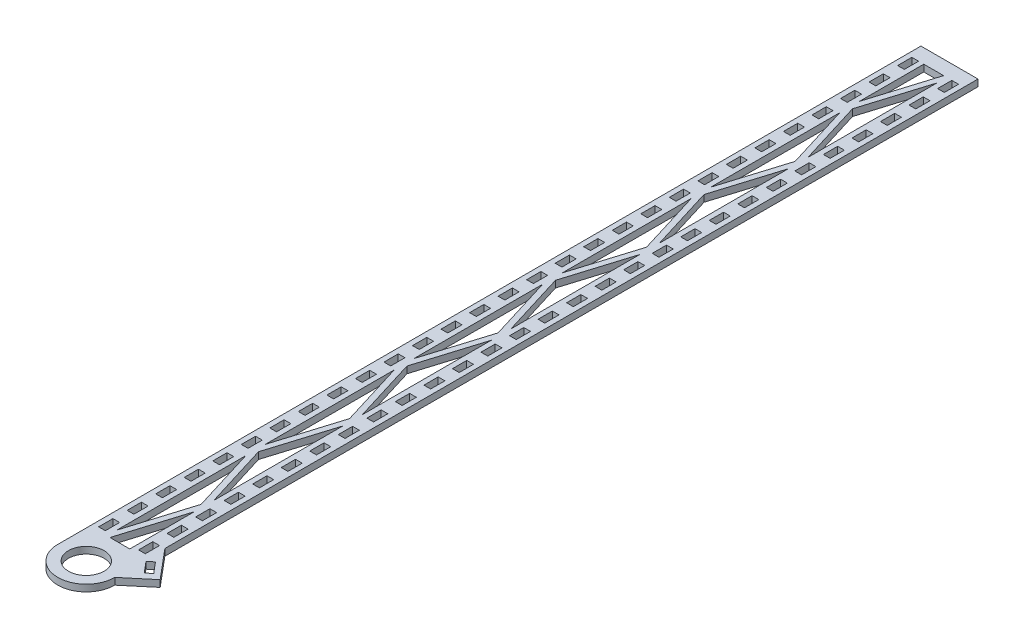
from build123d import *

# Parameters (mm, degrees)
SKETCH1_W               = 25.4
SKETCH1_H               = 384.175
BOSS_EXTRUDE1_DEPTH     = 1.5
BOSS_EXTRUDE2_DEPTH     = 3
SKETCH3_W               = 3
SKETCH3_H               = 6.35
SLOT1_DEPTH             = 207.173010022
SKETCH3_3_W             = 3
SKETCH3_3_H             = 6.35
SLOT2_DEPTH             = 207.173010022
ANGLESLOT_DEPTH         = 207.173010022
ANGLESLOT_DEPTH_BACK    = 207.173010022
SLOTS1_COUNT            = 34
SLOTS1_PITCH            = 12.7
LPATTERN2_COUNT         = 34
LPATTERN2_PITCH         = 12.7
CUT_EXTRUDE4_DEPTH      = 207.173010022
CUT_EXTRUDE4_DEPTH_BACK = 207.173010022
SKETCH5_R               = 7.9375
CUT_EXTRUDE5_DEPTH      = 207.173010022
CUT_EXTRUDE5_DEPTH_BACK = 207.173010022


with BuildPart() as part:
    # Sketch1 → Boss-Extrude1 (new, symmetric)
    with BuildSketch(Plane(origin=(0, 0, 0), x_dir=(1, 0, 0), z_dir=(0, 1, 0))):
        Rectangle(SKETCH1_W, SKETCH1_H)
    extrude(amount=BOSS_EXTRUDE1_DEPTH, both=True)

    # Sketch2 → Boss-Extrude2 (add)
    with BuildSketch(Plane(origin=(0, 1.5, 0), x_dir=(1, 0, 0), z_dir=(0, 1, 0))):
        with BuildLine():
            Line((-12.7, -192.0875), (12.7, -192.0875))
            ThreePointArc((12.7, -192.0875), (0, -179.3875), (-12.7, -192.0875))
        make_face()
        with BuildLine():
            ThreePointArc((-12.7, -192.0875), (0, -204.7875), (12.7, -192.0875))
            Line((12.7, -192.0875), (-12.7, -192.0875))
        make_face()
        Polygon((12.7, -169.803849374), (12.7, -192.0875), (23.672555951, -182.880432348), align=None)
    extrude(amount=-BOSS_EXTRUDE2_DEPTH)

    # Sketch3 → Slot1 (cut, symmetric)
    with BuildSketch(Plane(origin=(0, 1.5, 0), x_dir=(1, 0, 0), z_dir=(0, 1, 0))):
        with Locations((-8.89, -173.0375)):
            Rectangle(SKETCH3_W, SKETCH3_H)
    slot1 = extrude(amount=SLOT1_DEPTH, both=True, mode=Mode.SUBTRACT)

    # Sketch3<3> → Slot2 (cut, symmetric)
    with BuildSketch(Plane(origin=(0, 1.5, 0), x_dir=(1, 0, 0), z_dir=(0, 1, 0))):
        with Locations((8.89, -173.0375)):
            Rectangle(SKETCH3_3_W, SKETCH3_3_H)
    slot2 = extrude(amount=SLOT2_DEPTH, both=True, mode=Mode.SUBTRACT)

    # Sketch3<4> → AngleSlot (cut, two sides: drawn at the far end of the back side and taken through both)
    with BuildSketch(Plane(origin=(0, 1.5, 0), x_dir=(1, 0, 0), z_dir=(0, 1, 0)).offset(-ANGLESLOT_DEPTH_BACK)):
        Polygon((17.564009297, -183.861443449), (13.482307976, -178.997061235), (15.780441305, -177.068698406), (19.862142627, -181.93308062), align=None)
    extrude(amount=ANGLESLOT_DEPTH + ANGLESLOT_DEPTH_BACK, mode=Mode.SUBTRACT)

    # Slots1: Slot1 ×34
    with Locations(*[(0, 0, -i * SLOTS1_PITCH) for i in range(1, SLOTS1_COUNT)]):
        add(slot1, mode=Mode.SUBTRACT)

    # LPattern2: Slot2 ×34
    with Locations(*[(0, 0, -i * LPATTERN2_PITCH) for i in range(1, LPATTERN2_COUNT)]):
        add(slot2, mode=Mode.SUBTRACT)

    # Sketch5 → Cut-Extrude4 (cut, two sides: drawn at the far end of the back side and taken through both)
    with BuildSketch(Plane(origin=(0, 1.5, 0), x_dir=(1, 0, 0), z_dir=(0, 1, 0)).offset(-CUT_EXTRUDE4_DEPTH_BACK)):
        with Locations(Location((0, -192.0875, 0), (0, 0, 270))):
            Circle(SKETCH5_R)
    extrude(amount=CUT_EXTRUDE4_DEPTH + CUT_EXTRUDE4_DEPTH_BACK, mode=Mode.SUBTRACT)

    # Sketch6 → Cut-Extrude5 (cut, two sides: drawn at the far end of the back side and taken through both)
    with BuildSketch(Plane(origin=(0, 1.5, 0), x_dir=(1, 0, 0), z_dir=(0, 1, 0)).offset(-CUT_EXTRUDE5_DEPTH_BACK)):
        Polygon((-3.751341285, -177.8), (5.08, -177.8), (5.08, -149.073051788), align=None)
        Polygon((-5.08, -116.024188151), (-5.08, -173.478084576), (3.751341285, -144.751136364), align=None)
        Polygon((-3.751341285, -111.702272727), (5.08, -140.42922094), (5.08, -82.975324515), align=None)
        Polygon((-5.08, -49.926460879), (-5.08, -107.380357303), (3.751341285, -78.653409091), align=None)
        Polygon((-3.751341285, -45.604545455), (5.08, -74.331493667), (5.08, -16.877597242), align=None)
        Polygon((-5.08, 16.171266394), (-5.08, -41.282630031), (3.751341285, -12.555681818), align=None)
        Polygon((-3.751341285, 20.493181818), (5.08, -8.233766394), (5.08, 49.220130031), align=None)
        Polygon((-5.08, 82.268993667), (-5.08, 24.815097242), (3.751341285, 53.542045455), align=None)
        Polygon((-3.751341285, 86.590909091), (5.08, 57.863960879), (5.08, 115.317857303), align=None)
        Polygon((-5.08, 148.36672094), (-5.08, 90.912824515), (3.751341285, 119.639772727), align=None)
        Polygon((-3.751341285, 152.688636364), (5.08, 123.961688151), (5.08, 181.415584576), align=None)
        Polygon((-5.08, 185.7375), (-5.08, 157.010551788), (3.751341285, 185.7375), align=None)
    extrude(amount=CUT_EXTRUDE5_DEPTH + CUT_EXTRUDE5_DEPTH_BACK, mode=Mode.SUBTRACT)


solid = part.part
